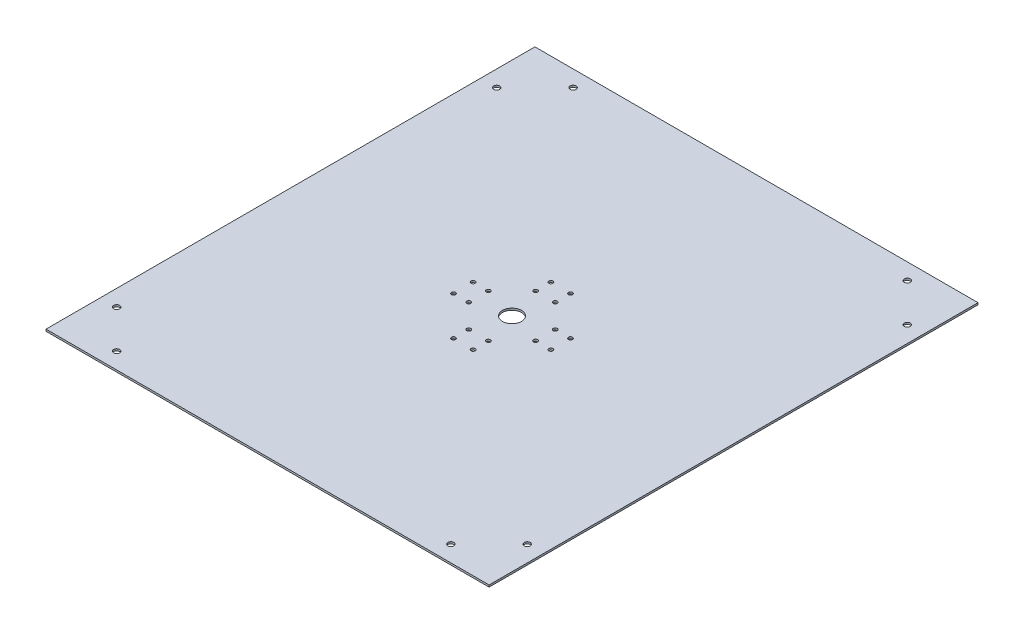
from build123d import *

# Parameters (mm, degrees)
SKETCH1_W           = 464
SKETCH1_H           = 512
BOSS_EXTRUDE1_DEPTH = 2
SKETCH2_R           = 10
CUT_EXTRUDE1_DEPTH  = 10
SKETCH3_R           = 2.15
CUT_EXTRUDE2_DEPTH  = 10
SKETCH4_R           = 3.15
CUT_EXTRUDE3_DEPTH  = 10


with BuildPart() as part:
    # Sketch1 → Boss-Extrude1 (new body)
    with BuildSketch(Plane(origin=(0, 0, 0), x_dir=(1, 0, 0), z_dir=(0, 1, 0))):
        Rectangle(SKETCH1_W, SKETCH1_H)
    extrude(amount=BOSS_EXTRUDE1_DEPTH)

    # Sketch2 → Cut-Extrude1 (cut)
    with BuildSketch(Plane(origin=(0, 2, 0), x_dir=(1, 0, 0), z_dir=(0, 1, 0))):
        with Locations(Location((0, 0, 0), (0, 0, 270))):
            Circle(SKETCH2_R)
    extrude(amount=-CUT_EXTRUDE1_DEPTH, mode=Mode.SUBTRACT)

    # Sketch3 → Cut-Extrude2 (cut)
    with BuildSketch(Plane(origin=(0, 2, 0), x_dir=(1, 0, 0), z_dir=(0, 1, 0))):
        with Locations(Location((-10.25, 51, 0), (0, 0, 270))):
            Circle(SKETCH3_R)
        with Locations(Location((-10.25, 35, 0), (0, 0, 270))):
            Circle(SKETCH3_R)
        with Locations(Location((10.25, 35, 0), (0, 0, 90))):
            Circle(SKETCH3_R)
        with Locations(Location((10.25, 51, 0), (0, 0, 90))):
            Circle(SKETCH3_R)
        with Locations(Location((35, 10.25, 0), (0, 0, 270))):
            Circle(SKETCH3_R)
        with Locations(Location((51, 10.25, 0), (0, 0, 270))):
            Circle(SKETCH3_R)
        with Locations(Location((51, -10.25, 0), (0, 0, 90))):
            Circle(SKETCH3_R)
        with Locations(Location((35, -10.25, 0), (0, 0, 90))):
            Circle(SKETCH3_R)
        with Locations(Location((10.25, -35, 0), (0, 0, 270))):
            Circle(SKETCH3_R)
        with Locations(Location((10.25, -51, 0), (0, 0, 270))):
            Circle(SKETCH3_R)
        with Locations(Location((-10.25, -51, 0), (0, 0, 90))):
            Circle(SKETCH3_R)
        with Locations(Location((-10.25, -35, 0), (0, 0, 90))):
            Circle(SKETCH3_R)
        with Locations(Location((-35, -10.25, 0), (0, 0, 270))):
            Circle(SKETCH3_R)
        with Locations(Location((-51, -10.25, 0), (0, 0, 270))):
            Circle(SKETCH3_R)
        with Locations(Location((-51, 10.25, 0), (0, 0, 90))):
            Circle(SKETCH3_R)
        with Locations(Location((-35, 10.25, 0), (0, 0, 90))):
            Circle(SKETCH3_R)
    extrude(amount=-CUT_EXTRUDE2_DEPTH, mode=Mode.SUBTRACT)

    # Sketch4 → Cut-Extrude3 (cut)
    with BuildSketch(Plane(origin=(0, 2, 0), x_dir=(1, 0, 0), z_dir=(0, 1, 0))):
        with Locations(Location((-215, -199, 0), (0, 0, 270))):
            Circle(SKETCH4_R)
        with Locations(Location((-175, -239, 0), (0, 0, 270))):
            Circle(SKETCH4_R)
        with Locations(Location((-215, 199, 0), (0, 0, 90))):
            Circle(SKETCH4_R)
        with Locations(Location((-175, 239, 0), (0, 0, 90))):
            Circle(SKETCH4_R)
        with Locations(Location((175, -239, 0), (0, 0, 90))):
            Circle(SKETCH4_R)
        with Locations(Location((215, -199, 0), (0, 0, 90))):
            Circle(SKETCH4_R)
        with Locations(Location((215, 199, 0), (0, 0, 270))):
            Circle(SKETCH4_R)
        with Locations(Location((175, 239, 0), (0, 0, 270))):
            Circle(SKETCH4_R)
    extrude(amount=-CUT_EXTRUDE3_DEPTH, mode=Mode.SUBTRACT)


solid = part.part
